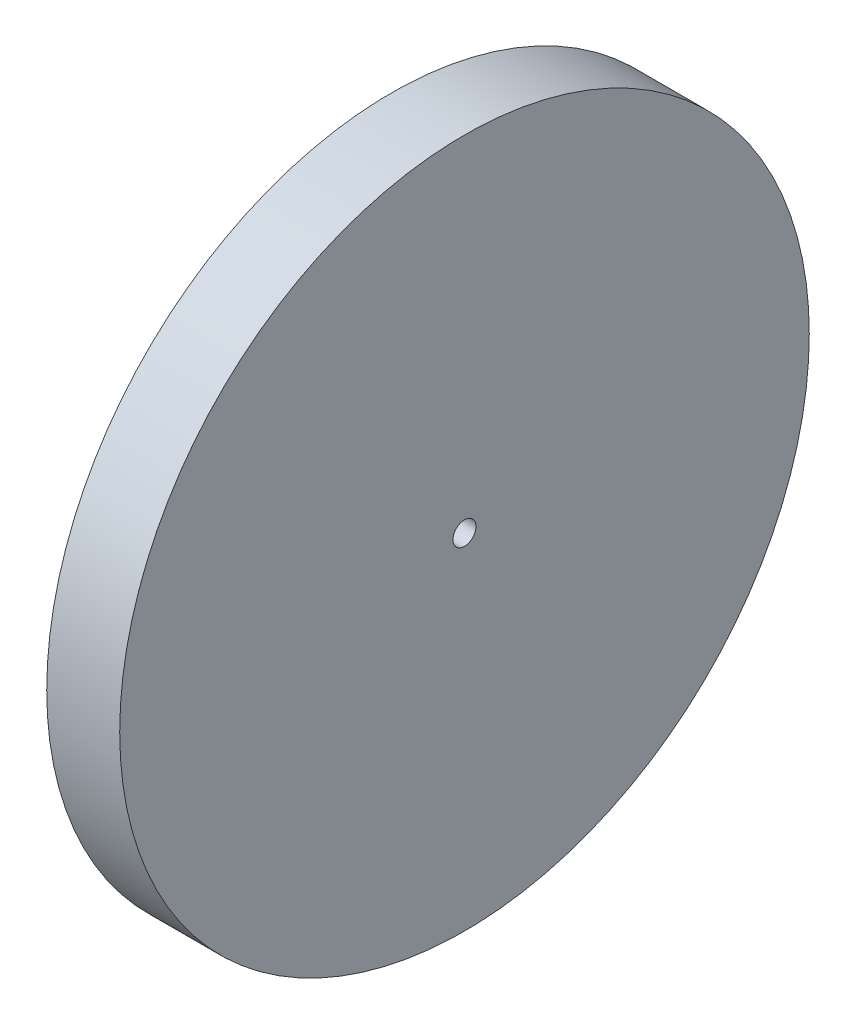
from build123d import *

# Parameters (mm, degrees)
SKETCH1_R           = 30
SKETCH1_R_2         = 1
BOSS_EXTRUDE1_DEPTH = 6.35


with BuildPart() as part:
    # Sketch1 → Boss-Extrude1 (new body)
    with BuildSketch(Plane(origin=(0, 0, 0), x_dir=(0, 0, -1), z_dir=(1, 0, 0))):
        Circle(SKETCH1_R)
        Circle(SKETCH1_R_2, mode=Mode.SUBTRACT)
    extrude(amount=BOSS_EXTRUDE1_DEPTH)


solid = part.part
